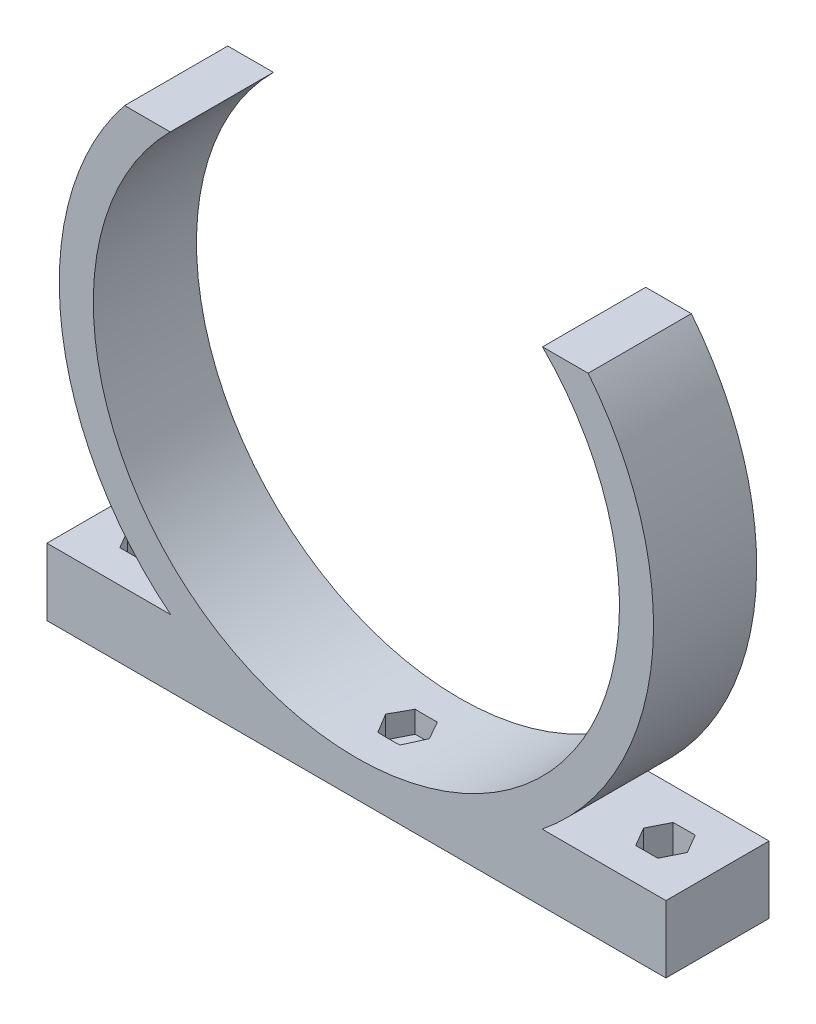
from build123d import *

# Parameters (mm, degrees)
BOSS_EXTRUDE1_DEPTH = 12.7
SKETCH3_R           = 1.27
CUT_EXTRUDE1_DEPTH  = 12.7
CUT_EXTRUDE2_DEPTH  = 3.937
LPATTERN1_COUNT     = 3
LPATTERN1_PITCH     = 31.75
CUT_EXTRUDE3_DEPTH  = 2.54


with BuildPart() as part:
    # Sketch2 → Boss-Extrude1 (new body)
    with BuildSketch(Plane.XY):
        with BuildLine():
            Line((0, 0), (38.1, 0))
            Line((38.1, 0), (38.1, 8.255))
            Line((38.1, 8.255), (22.86, 8.255))
            ThreePointArc((22.86, 8.255), (36.352714712, 32.797844463), (28.528615071, 59.69))
            Line((28.528615071, 59.69), (22.910736376, 59.69))
            ThreePointArc((22.910736376, 59.69), (-0.00316084, 4.419599864), (-22.917058056, 59.69))
            Line((-22.917058056, 59.69), (-28.534936751, 59.69))
            ThreePointArc((-28.534936751, 59.69), (-36.359036392, 32.797844463), (-22.86632168, 8.255))
            Line((-22.86632168, 8.255), (-38.1, 8.255))
            Line((-38.1, 8.255), (-38.1, 0))
            Line((-38.1, 0), (0, 0))
        make_face()
    extrude(amount=BOSS_EXTRUDE1_DEPTH)

    # Sketch3 → Cut-Extrude1 (cut)
    with BuildSketch(Plane.XZ):
        with Locations(Location((0, 6.35, 0), (0, 0, 270))):
            Circle(SKETCH3_R)
        with Locations(Location((31.75, 6.35, 0), (0, 0, 270))):
            Circle(SKETCH3_R)
        with Locations(Location((-31.75, 6.35, 0), (0, 0, 270))):
            Circle(SKETCH3_R)
    extrude(amount=-CUT_EXTRUDE1_DEPTH, mode=Mode.SUBTRACT)

    # Sketch4 → Cut-Extrude2 (cut)
    with BuildSketch(Plane(origin=(0, 8.255, 0), x_dir=(1, 0, 0), z_dir=(0, 1, 0))):
        Polygon((-30.415911199, -8.690045044), (-33.129332156, -8.690045044), (-34.502956004, -6.35), (-33.28343783, -3.926071637), (-30.570033405, -3.91660003), (-29.20512854, -6.26174139), align=None)
    cut_extrude2 = extrude(amount=-CUT_EXTRUDE2_DEPTH, mode=Mode.SUBTRACT)

    # LPattern1: Cut-Extrude2 ×3
    with Locations(*[(i * LPATTERN1_PITCH, 0, 0) for i in range(1, LPATTERN1_COUNT)]):
        add(cut_extrude2, mode=Mode.SUBTRACT)

    # Sketch6 → Cut-Extrude3 (cut)
    with BuildSketch(Plane(origin=(0, 4.318, 0), x_dir=(1, 0, 0), z_dir=(0, 1, 0))):
        Polygon((1.334088801, -8.690045044), (-1.379332156, -8.690045044), (-2.752956004, -6.35), (-1.53343783, -3.926071637), (1.179966595, -3.91660003), (2.54487146, -6.26174139), align=None)
    extrude(amount=-CUT_EXTRUDE3_DEPTH, mode=Mode.SUBTRACT)


solid = part.part
